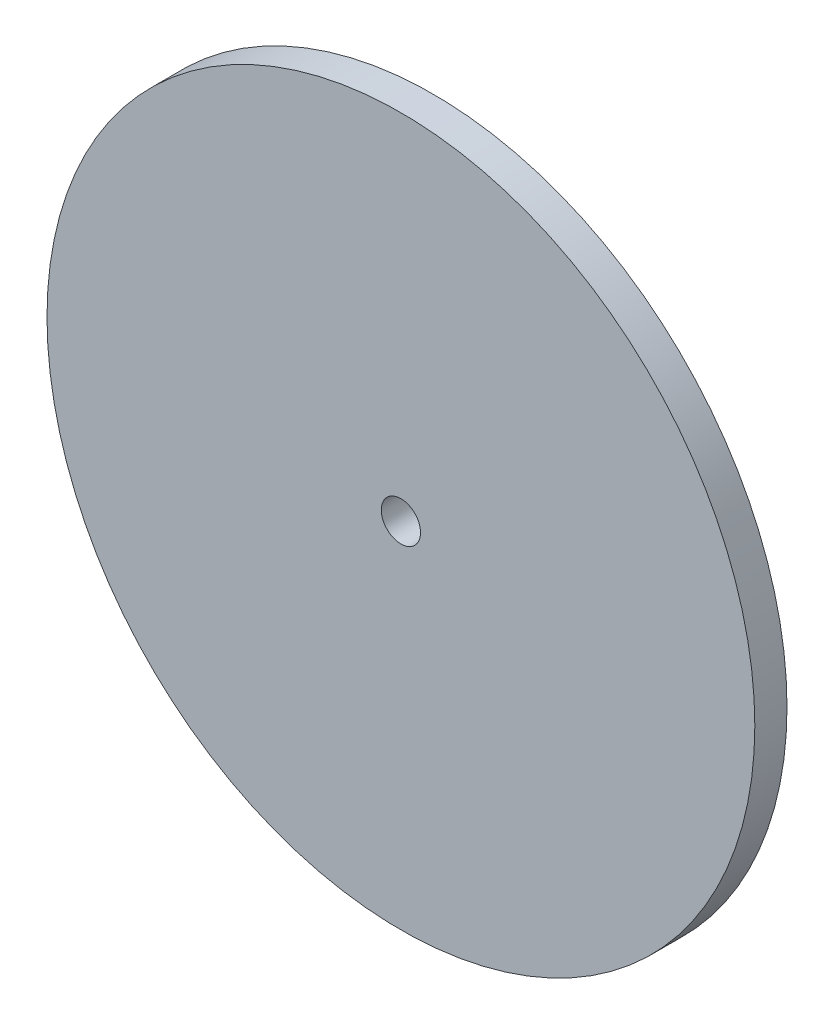
from build123d import *

# Parameters (mm, degrees)
SKETCH_1_R      = 55
SKETCH_1_R_2    = 3.05
EXTRUDE_1_DEPTH = 5


with BuildPart() as part:
    # 草图1 → 凸台-拉伸1 (new body)
    with BuildSketch(Plane.XY):
        Circle(SKETCH_1_R)
        Circle(SKETCH_1_R_2, mode=Mode.SUBTRACT)
    extrude(amount=EXTRUDE_1_DEPTH)


solid = part.part
